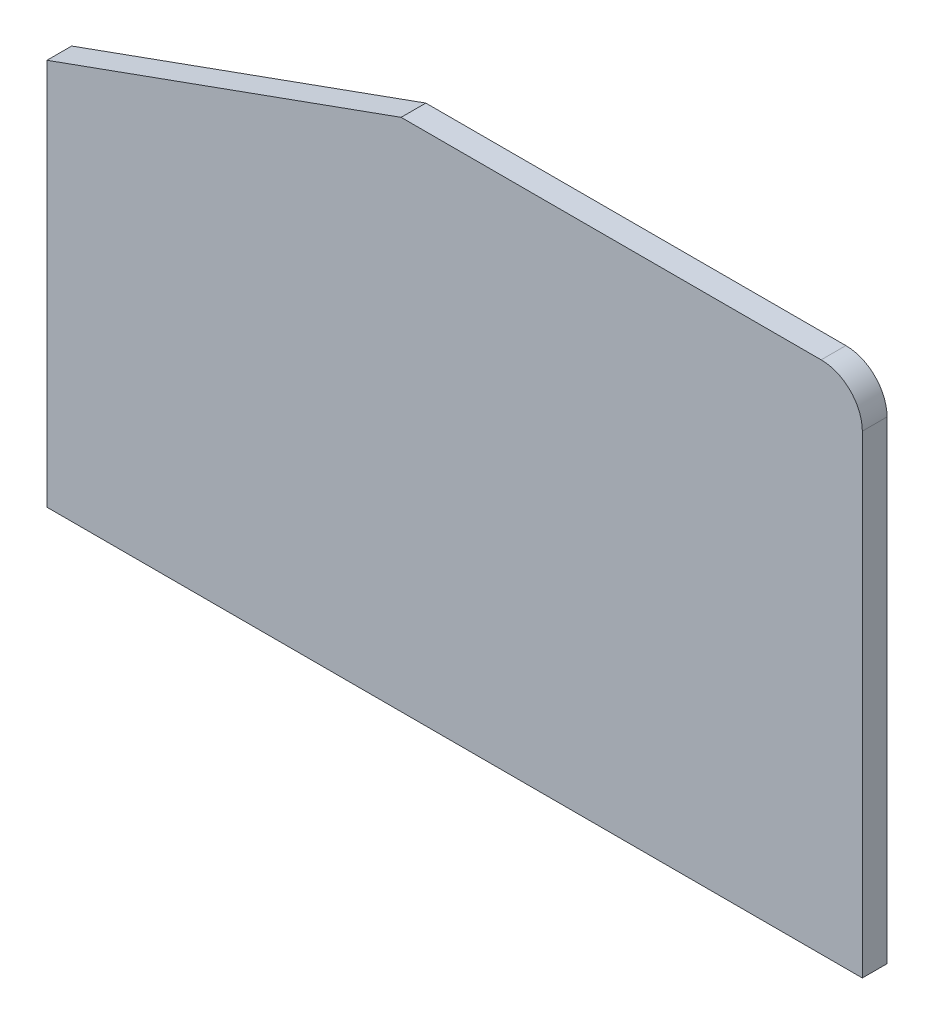
from build123d import *

# Parameters (mm, degrees)
BOSS_EXTRUDE1_DEPTH = 3
FILLET1_R           = 10


with BuildPart() as part:
    # Sketch1 → Boss-Extrude1 (new, symmetric)
    with BuildSketch(Plane.XY):
        Polygon((-99, 31.5), (-13, 62.5), (99, 62.5), (99, -62.5), (-99, -62.5), align=None)
    extrude(amount=BOSS_EXTRUDE1_DEPTH, both=True)

    # Fillet1
    fillet1_edges = [part.edges().sort_by_distance(p)[0] for p in [
        (99, 62.5, 0),
    ]]
    fillet(fillet1_edges, radius=FILLET1_R)


solid = part.part
